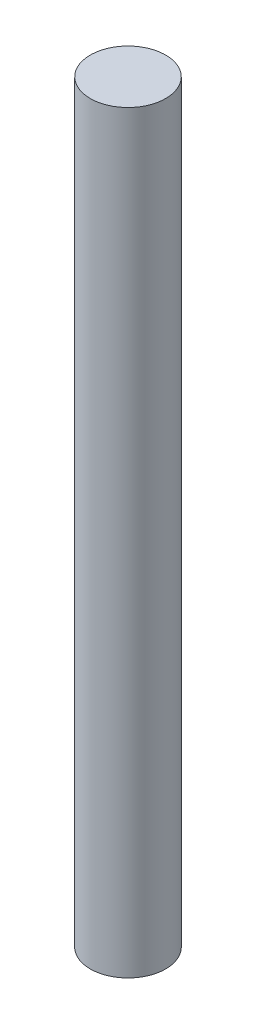
from build123d import *

# Parameters (mm, degrees)
SKETCH1_R           = 0.5
BOSS_EXTRUDE1_DEPTH = 10


with BuildPart() as part:
    # Sketch1 → Boss-Extrude1 (new body)
    with BuildSketch(Plane(origin=(0, 0, 0), x_dir=(1, 0, 0), z_dir=(0, 1, 0))):
        with Locations(Location((-4.337030143, 0.868917189, 0), (0, 0, 270))):
            Circle(SKETCH1_R)
    extrude(amount=BOSS_EXTRUDE1_DEPTH)


solid = part.part
